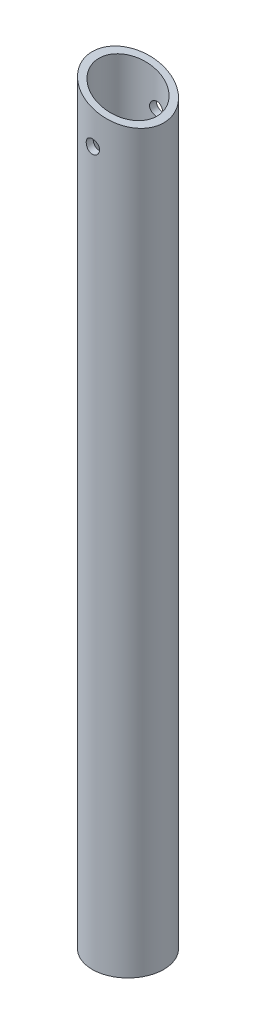
from build123d import *

# Parameters (mm, degrees)
IZIM1_R                     = 8
IZIM1_R_2                   = 6.5
Y_KSEKLIK_EKSTR_ZYON1_DEPTH = 170
IZIM3_R                     = 1.5
KES_EKSTR_ZYON1_DEPTH       = 10


with BuildPart() as part:
    # Çizim1 → Yükseklik-Ekstrüzyon1 (new body)
    with BuildSketch(Plane(origin=(0, 0, 0), x_dir=(1, 0, 0), z_dir=(0, 1, 0))):
        with Locations(Location((0, 0, 0), (0, 0, 270))):
            Circle(IZIM1_R)
        with Locations(Location((0, 0, 0), (0, 0, 270))):
            Circle(IZIM1_R_2, mode=Mode.SUBTRACT)
    extrude(amount=Y_KSEKLIK_EKSTR_ZYON1_DEPTH)

    # Çizim3 → Kes-Ekstrüzyon1 (cut, symmetric)
    with BuildSketch(Plane.XY):
        with Locations((0, 159.588238126)):
            Circle(IZIM3_R)
        Polygon((-8, 170), (8, 164.176476252), (8, 170), align=None)
    extrude(amount=KES_EKSTR_ZYON1_DEPTH, both=True, mode=Mode.SUBTRACT)


solid = part.part
